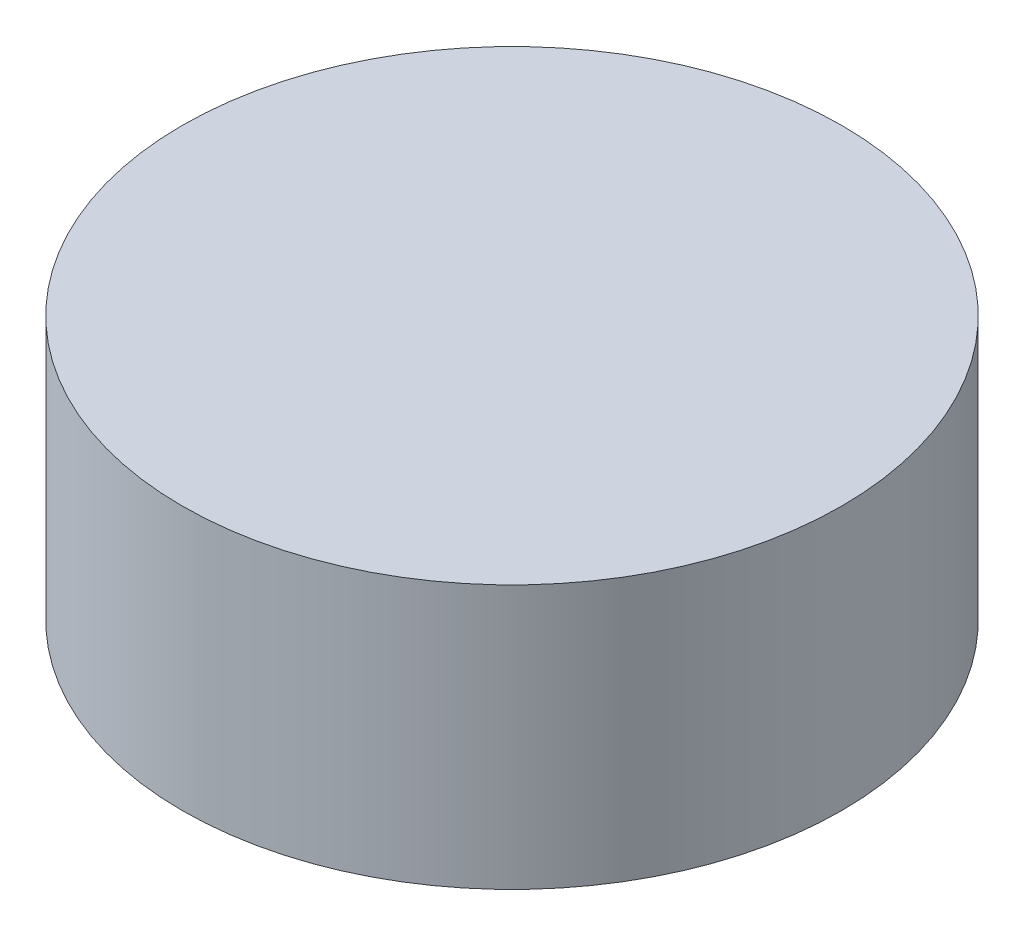
from build123d import *

# Parameters (mm, degrees)
SKETCH1_R           = 32.750000032
BOSS_EXTRUDE1_DEPTH = 26.199999924
SKETCH3_R           = 22.749999966
CUT_EXTRUDE1_DEPTH  = 8.399999964
CUT_EXTRUDE2_DEPTH  = 4.49999989


with BuildPart() as part:
    # Sketch1 → Boss-Extrude1 (new body)
    with BuildSketch(Plane(origin=(0, 0, 0), x_dir=(1, 0, 0), z_dir=(0, 1, 0))):
        with Locations(Location((0, 0, 0), (0, 0, 270))):
            Circle(SKETCH1_R)
    extrude(amount=BOSS_EXTRUDE1_DEPTH)

    # Sketch3 → Cut-Extrude1 (cut)
    with BuildSketch(Plane.XZ):
        with Locations(Location((0, 0, 0), (0, 0, 270))):
            Circle(SKETCH3_R)
    extrude(amount=-CUT_EXTRUDE1_DEPTH, mode=Mode.SUBTRACT)

    # Sketch4 → Cut-Extrude2 (cut)
    with BuildSketch(Plane.XZ.offset(-8.399999964)):
        Polygon((-5.851405972, -3.709588544), (0.286894931, -6.922260491), (6.138300902, -3.212671947), (5.851405972, 3.709588544), (-0.286894931, 6.922260491), (-6.138300902, 3.212671947), align=None)
    extrude(amount=-CUT_EXTRUDE2_DEPTH, mode=Mode.SUBTRACT)


solid = part.part
